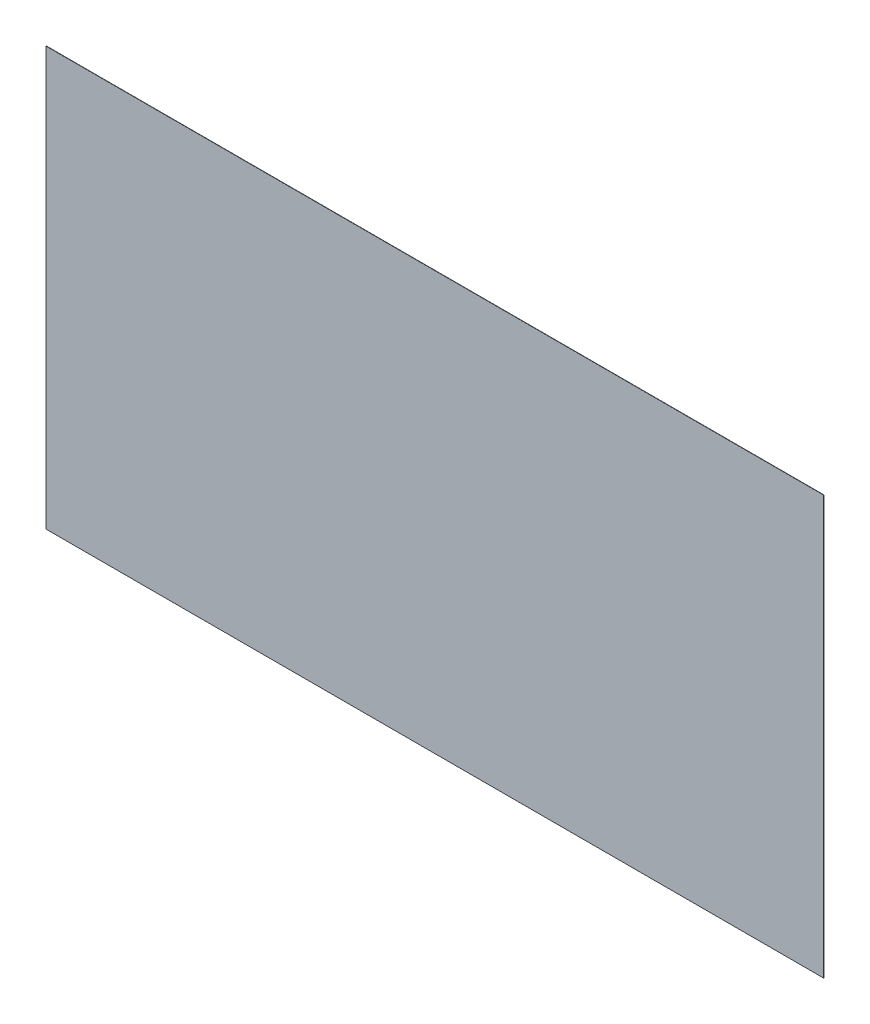
from build123d import *

# Parameters (mm, degrees)
SKETCH1_W           = 2100
SKETCH1_H           = 1130
BOSS_EXTRUDE1_DEPTH = 0.9
SHELL1_T            = -0.35


with BuildPart() as part:
    # Sketch1 → Boss-Extrude1 (new body)
    with BuildSketch(Plane.XY):
        Rectangle(SKETCH1_W, SKETCH1_H)
    extrude(amount=BOSS_EXTRUDE1_DEPTH)

    # Shell1
    shell1_openings = [part.faces().sort_by_distance(p)[0] for p in [
        (0, 565, 0.45),
    ]]
    offset(amount=SHELL1_T, openings=shell1_openings, kind=Kind.INTERSECTION)


solid = part.part
